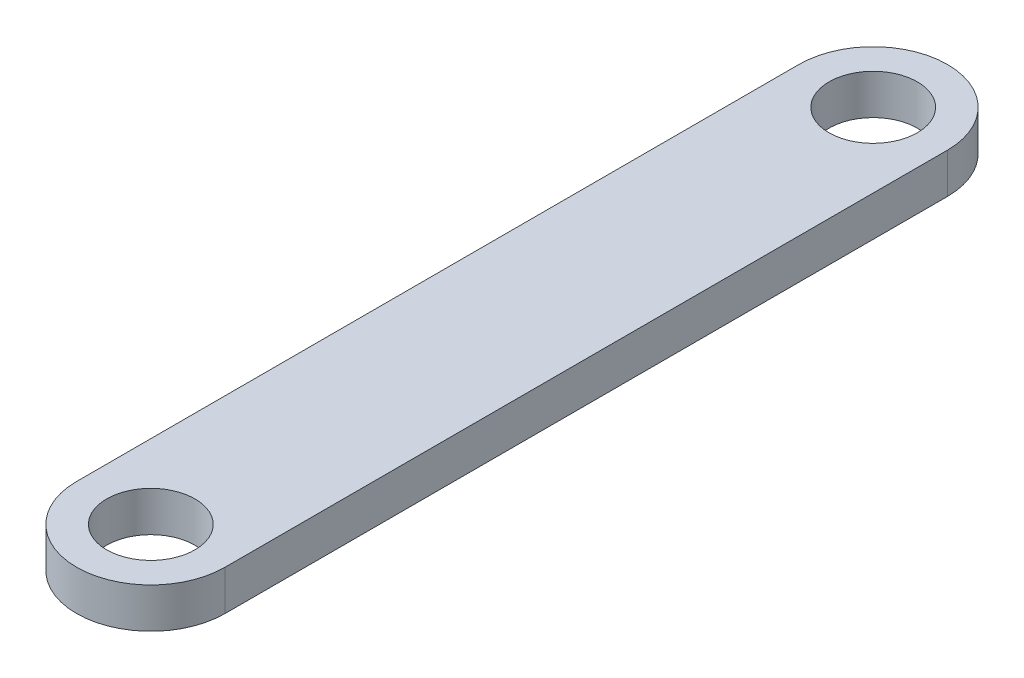
from build123d import *

# Parameters (mm, degrees)
SKETCH1_R           = 11
BOSS_EXTRUDE1_DEPTH = 10


with BuildPart() as part:
    # Sketch1 → Boss-Extrude1 (new body)
    with BuildSketch(Plane(origin=(0, 0, 0), x_dir=(1, 0, 0), z_dir=(0, 1, 0))):
        with BuildLine():
            Line((-18.5, -90), (-18.5, 90))
            ThreePointArc((-18.5, 90), (0, 108.5), (18.5, 90))
            Line((18.5, 90), (18.5, -90))
            ThreePointArc((18.5, -90), (0, -108.5), (-18.5, -90))
        make_face()
        with Locations(Location((0, 90, 0), (0, 0, 270))):
            Circle(SKETCH1_R, mode=Mode.SUBTRACT)
        with Locations(Location((0, -90, 0), (0, 0, 270))):
            Circle(SKETCH1_R, mode=Mode.SUBTRACT)
    extrude(amount=BOSS_EXTRUDE1_DEPTH)


solid = part.part
